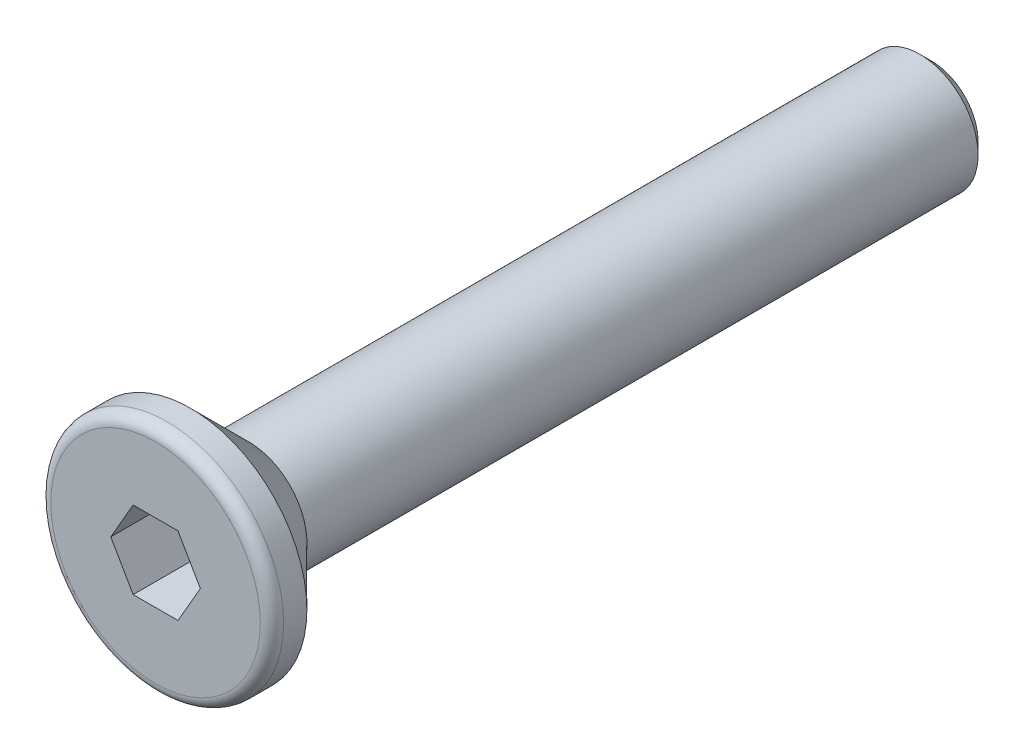
from build123d import *

# Parameters (mm, degrees)
CUT_EXTRUDE_1_DEPTH = 1.5
FILLET_1_R          = 0.3


with BuildPart() as part:
    # 草图1 → 旋转1 (revolve)
    with BuildSketch(Plane(origin=(0, 0, 0), x_dir=(0, 0, -1), z_dir=(1, 0, 0)), mode=Mode.PRIVATE) as revolve_1_sk:
        Polygon((-10, 0), (-10, 3), (-9.1, 3), (-7.6, 1.5), (9.7, 1.5), (10, 1.2), (10, 0), align=None)
    revolve(revolve_1_sk.sketch.rotate(Axis((0, 0, -10), (0, 0, 1)), 90), axis=Axis((0, 0, -10), (0, 0, 1)))

    # 草图2 → 切除-拉伸1 (cut)
    with BuildSketch(Plane.XY.offset(10)):
        Polygon((1.154700538, 0), (0.577350269, 1), (-0.577350269, 1), (-1.154700538, 0), (-0.577350269, -1), (0.577350269, -1), align=None)
    extrude(amount=-CUT_EXTRUDE_1_DEPTH, mode=Mode.SUBTRACT)

    # 圆角1
    fillet_1_edges = [part.edges().sort_by_distance(p)[0] for p in [
        (3, 0, 10),
    ]]
    fillet(fillet_1_edges, radius=FILLET_1_R)


solid = part.part
